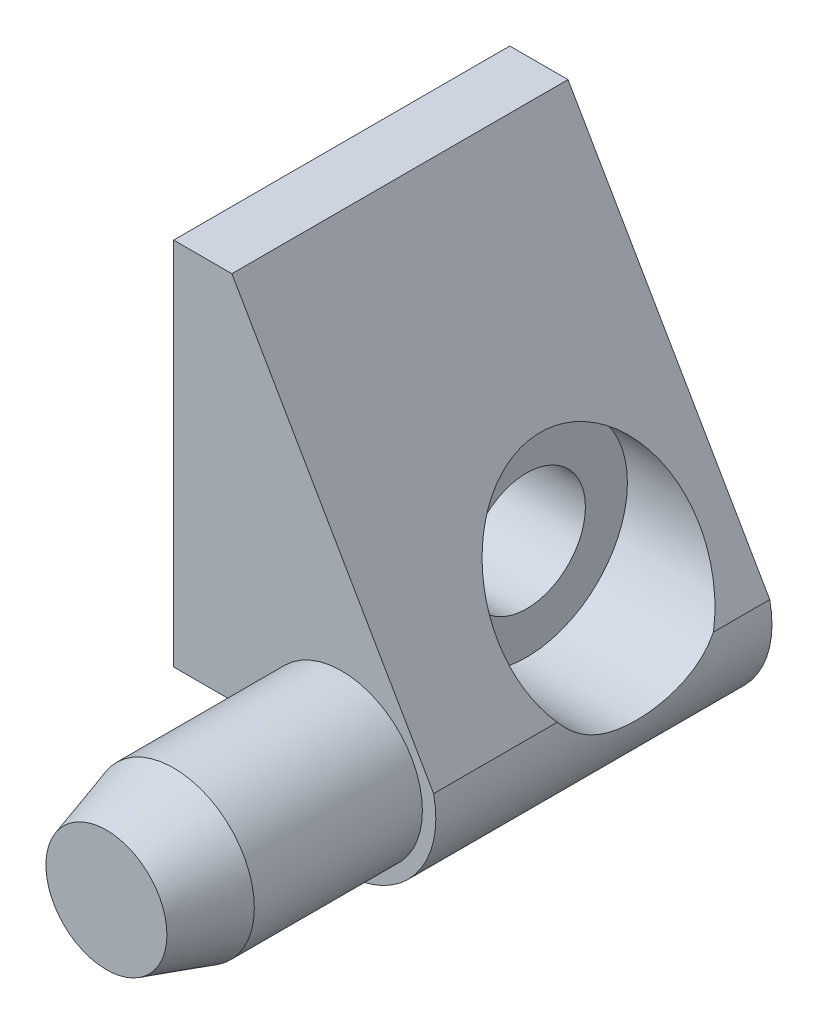
from build123d import *

# Parameters (mm, degrees)
BOSS_EXTRU_1_DEPTH                                = 10
CHAMBRAGE_POUR_VIS_T_TE_COURTE_BOMB_E_D           = 3.5
CHAMBRAGE_POUR_VIS_T_TE_COURTE_BOMB_E_CBORE_D     = 6
CHAMBRAGE_POUR_VIS_T_TE_COURTE_BOMB_E_CBORE_DEPTH = 3.3


with BuildPart() as part:
    # Esquisse1 → Boss.-Extru.1 (new body)
    with BuildSketch(Plane(origin=(0, 0, 0), x_dir=(-1, 0, 0), z_dir=(0, 0, -1))):
        with BuildLine():
            Line((2.8, 6), (5, 6))
            Line((5, 6), (5, 17))
            Line((5, 17), (3.267949192, 17))
            Line((3.267949192, 17), (-2.734012588, 6.604297251))
            ThreePointArc((-2.734012588, 6.604297251), (-0.303944693, 3.216545739), (2.8, 6))
        make_face()
    extrude(amount=-BOSS_EXTRU_1_DEPTH)

    # Esquisse2 → Révolution1 (revolve)
    with BuildSketch(Plane(origin=(0, 6, 0), x_dir=(1, 0, 0), z_dir=(0, 1, 0))):
        Polygon((2.4, -10), (0, -10), (0, -17), (1.8, -17), (2.4, -15), align=None)
    revolve(axis=Axis((0, 6, 10), (0, 0, 1)))

    # Chambrage pour vis à tête courte bombée à empreinte cruciforme #51 (through all)
    with Locations(Plane(origin=(2.8, 0, 0), x_dir=(0, 0, -1), z_dir=(1, 0, 0))):
        with Locations((-4, 8.5)):
            CounterBoreHole(CHAMBRAGE_POUR_VIS_T_TE_COURTE_BOMB_E_D / 2, CHAMBRAGE_POUR_VIS_T_TE_COURTE_BOMB_E_CBORE_D / 2, CHAMBRAGE_POUR_VIS_T_TE_COURTE_BOMB_E_CBORE_DEPTH)


solid = part.part
